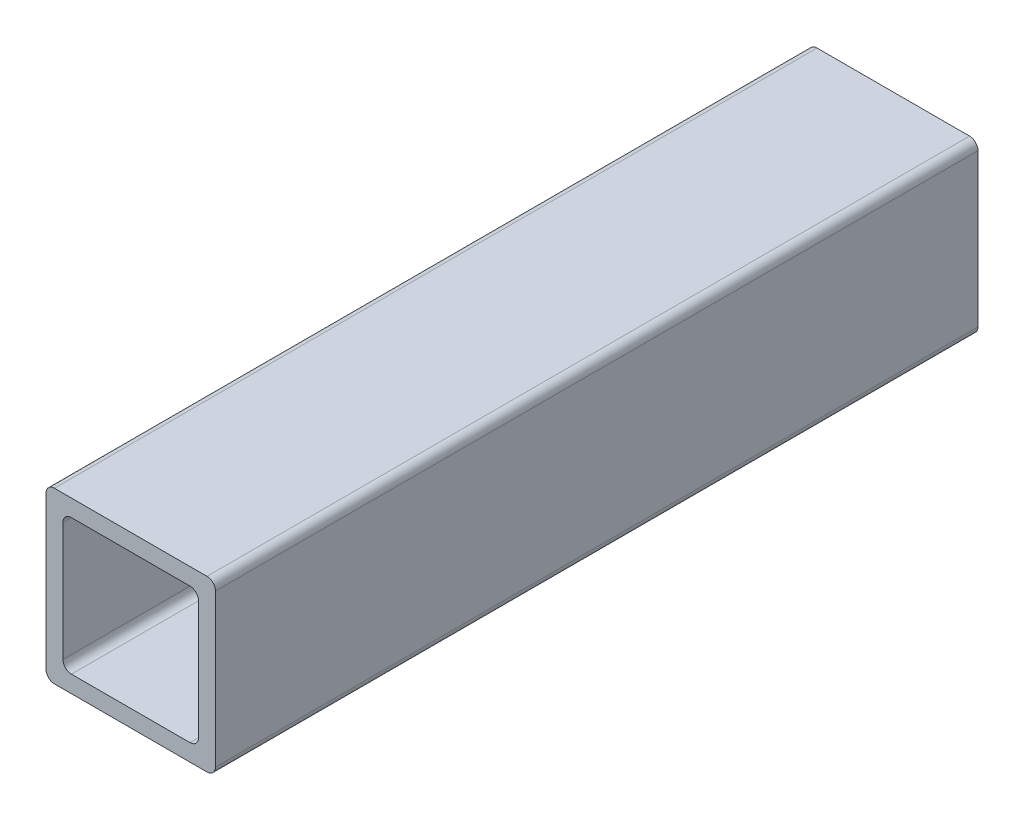
from build123d import *

# Parameters (mm, degrees)
BOSS_EXTRU_1_DEPTH = 180


with BuildPart() as part:
    # Esquisse2 → Boss.-Extru.1 (new body)
    with BuildSketch(Plane.XY):
        with BuildLine():
            Line((2, 0), (38, 0))
            ThreePointArc((38, 0), (39.414213562, 0.585786438), (40, 2))
            Line((40, 2), (40, 38))
            ThreePointArc((40, 38), (39.414213562, 39.414213562), (38, 40))
            Line((38, 40), (2, 40))
            ThreePointArc((2, 40), (0.585786438, 39.414213562), (0, 38))
            Line((0, 38), (0, 2))
            ThreePointArc((0, 2), (0.585786438, 0.585786438), (2, 0))
        make_face()
        with BuildLine():
            Line((6, 4), (34, 4))
            ThreePointArc((34, 4), (35.414213562, 4.585786438), (36, 6))
            Line((36, 6), (36, 34))
            ThreePointArc((36, 34), (35.414213562, 35.414213562), (34, 36))
            Line((34, 36), (6, 36))
            ThreePointArc((6, 36), (4.585786438, 35.414213562), (4, 34))
            Line((4, 34), (4, 6))
            ThreePointArc((4, 6), (4.585786438, 4.585786438), (6, 4))
        make_face(mode=Mode.SUBTRACT)
    extrude(amount=BOSS_EXTRU_1_DEPTH)


solid = part.part
